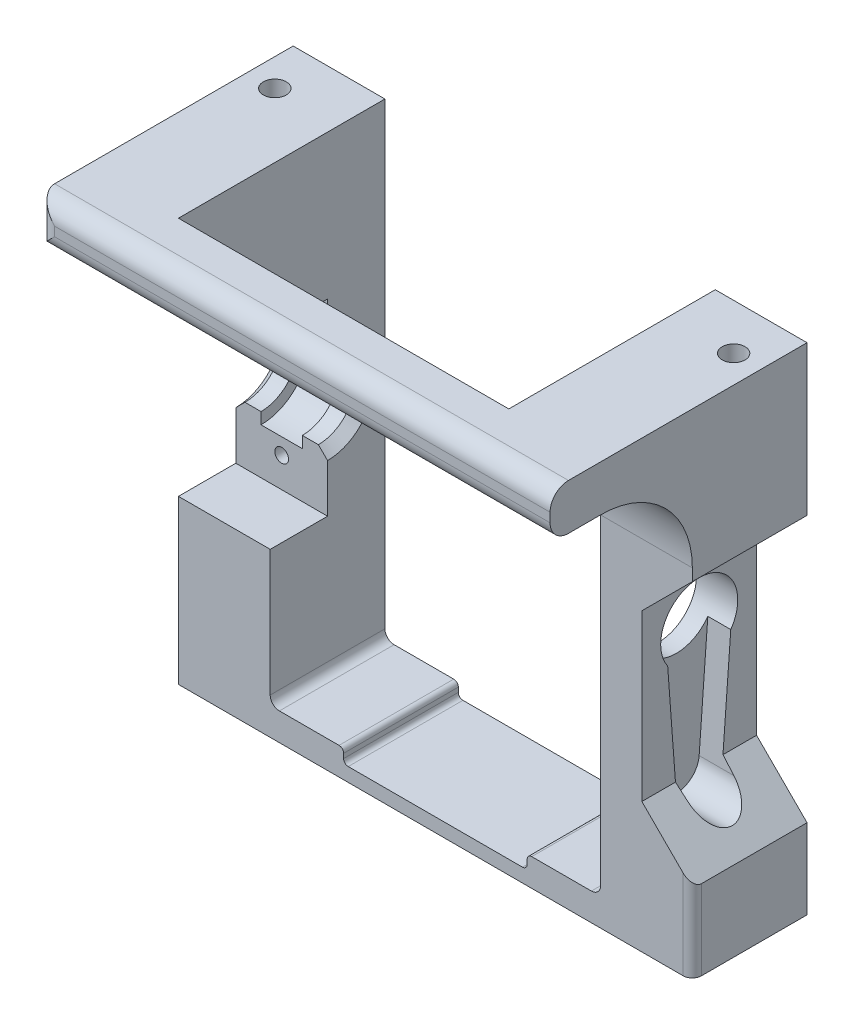
from build123d import *

# Parameters (mm, degrees)
SKETCH_1_W             = 56
SKETCH_1_H             = 54
EXTRUDE_492_DEPTH      = 12.5
SKETCH_3_W             = 36
SKETCH_3_H             = 46
CUT_EXTRUDE_735_DEPTH  = 41.856456038
SKETCH_11_R            = 1.25
CUT_EXTRUDE_988_DEPTH  = 10
CUT_EXTRUDE_1455_DEPTH = 8
CUT_EXTRUDE_1797_REACH = 65.413
SKETCH_4_R             = 4.2
SKETCH_6_R             = 4
CUT_EXTRUDE_1934_DEPTH = 10
SKETCH_7_W             = 6.25
SKETCH_7_H             = 20.5
CUT_EXTRUDE_2133_DEPTH = 10
SKETCH_8_R             = 5.25
CUT_EXTRUDE_2310_DEPTH = 2.25
SKETCH_9_R             = 0.75
CUT_EXTRUDE_2668_DEPTH = 4.75
CUT_EXTRUDE_3065_DEPTH = 41.856456038
CHAMFER_1_SIZE         = 1
FILLET_1_R             = 1
SKETCH_12_W            = 20
SKETCH_12_H            = 1.5
CUT_EXTRUDE_3477_DEPTH = 41.856456038
FILLET_2_R             = 0.5
CUT_EXTRUDE_4202_REACH = 42.856
SKETCH_13_W            = 36
SKETCH_13_H            = 5
EXTRUDE_4562_DEPTH     = 5
FILLET_3_R             = 10
FILLET_4_R             = 2
FILLET_6_R             = 1


with BuildPart() as part:
    # Эскиз1 → Extrude 492 (new body)
    with BuildSketch(Plane.XY):
        Rectangle(SKETCH_1_W, SKETCH_1_H)
    extrude(amount=EXTRUDE_492_DEPTH)

    # Эскиз3 → Cut-Extrude 735 (cut, through all)
    with BuildSketch(Plane.XY.offset(12.5)):
        with Locations((0, -1)):
            Rectangle(SKETCH_3_W, SKETCH_3_H)
    extrude(amount=-CUT_EXTRUDE_735_DEPTH, mode=Mode.SUBTRACT)

    # Эскиз11 → Cut-Extrude 988 (cut)
    with BuildSketch(Plane.XZ.offset(27)):
        with Locations(Location((-25, 5, 0), (0, 0, 270))):
            Circle(SKETCH_11_R)
        with Locations(Location((25, 5, 0), (0, 0, 270))):
            Circle(SKETCH_11_R)
    cut_extrude_988 = extrude(amount=-CUT_EXTRUDE_988_DEPTH, mode=Mode.SUBTRACT)

    # Mirror 1032: Cut-Extrude 988 across plane
    add(cut_extrude_988.mirror(Plane.ZX), mode=Mode.SUBTRACT)

    # Эскиз5 → Cut-Extrude 1455 (cut)
    with BuildSketch(Plane(origin=(28, 0, 0), x_dir=(0, 0, -1), z_dir=(1, 0, 0))):
        with BuildLine():
            Line((-9.688027281, -1.412461071), (-8.743079599, -14.085887362))
            ThreePointArc((-8.743079599, -14.085887362), (-6.25, -16.4), (-3.756920401, -14.085887362))
            Line((-3.756920401, -14.085887362), (-2.811972719, -1.412461071))
            ThreePointArc((-2.811972719, -1.412461071), (-6.25, 5.2), (-9.688027281, -1.412461071))
        make_face()
    extrude(amount=-CUT_EXTRUDE_1455_DEPTH, mode=Mode.SUBTRACT)

    # Эскиз4 → Cut-Extrude 1797 (cut, up to next)
    with BuildSketch(Plane(origin=(28, 0, 0), x_dir=(0, 0, -1), z_dir=(1, 0, 0)), mode=Mode.PRIVATE) as cut_extrude_1797_sk1:
        with Locations((-6.25, 1)):
            Circle(SKETCH_4_R)
    cut_extrude_1797_tool1 = extrude(cut_extrude_1797_sk1.sketch, amount=-CUT_EXTRUDE_1797_REACH, mode=Mode.PRIVATE) & part.part
    add(cut_extrude_1797_tool1.solids().sort_by_distance((28, 1, 6.25))[0], mode=Mode.SUBTRACT)

    # Эскиз6 → Cut-Extrude 1934 (cut)
    with BuildSketch(Plane.ZY.offset(28)):
        with Locations((6.25, 1)):
            Circle(SKETCH_6_R)
    extrude(amount=-CUT_EXTRUDE_1934_DEPTH, mode=Mode.SUBTRACT)

    # Эскиз7 → Cut-Extrude 2133 (cut)
    with BuildSketch(Plane.ZY.offset(28)):
        with Locations((9.375, 1)):
            Rectangle(SKETCH_7_W, SKETCH_7_H)
    extrude(amount=-CUT_EXTRUDE_2133_DEPTH, mode=Mode.SUBTRACT)

    # Эскиз8 → Cut-Extrude 2310 (cut, symmetric)
    with BuildSketch(Plane.ZY.offset(23)):
        with Locations((6.25, 1)):
            Circle(SKETCH_8_R)
    extrude(amount=CUT_EXTRUDE_2310_DEPTH, both=True, mode=Mode.SUBTRACT)

    # Эскиз9 → Cut-Extrude 2668 (cut)
    with BuildSketch(Plane.XY.offset(6.25)):
        with Locations((-23, 8)):
            Circle(SKETCH_9_R)
        with Locations((-23, -6)):
            Circle(SKETCH_9_R)
    extrude(amount=-CUT_EXTRUDE_2668_DEPTH, mode=Mode.SUBTRACT)

    # Эскиз10 → Cut-Extrude 3065 (cut, through all)
    with BuildSketch(Plane.XY.offset(12.5)):
        Polygon((28, -18.3), (28, 10.7), (22.5, 5.2), (22.5, -12.8), align=None)
    extrude(amount=-CUT_EXTRUDE_3065_DEPTH, mode=Mode.SUBTRACT)

    # Фаска1
    chamfer_1_edges = [part.edges().sort_by_distance(p)[0] for p in [
        (-28, 1, 2.25),
        (-18, 1, 2.25),
    ]]
    chamfer(chamfer_1_edges, length=CHAMFER_1_SIZE)

    # Скругление1
    fillet_1_edges = [part.edges().sort_by_distance(p)[0] for p in [
        (18, -24, 6.25),
        (-18, -24, 6.25),
    ]]
    fillet(fillet_1_edges, radius=FILLET_1_R)

    # Эскиз12 → Cut-Extrude 3477 (cut, through all)
    with BuildSketch(Plane.XY):
        with Locations((0, -24.75)):
            Rectangle(SKETCH_12_W, SKETCH_12_H)
    extrude(amount=CUT_EXTRUDE_3477_DEPTH, mode=Mode.SUBTRACT)

    # Скругление2
    fillet_2_edges = [part.edges().sort_by_distance(p)[0] for p in [
        (-10, -24, 6.25),
        (-10, -25.5, 6.25),
        (10, -25.5, 6.25),
        (10, -24, 6.25),
    ]]
    fillet(fillet_2_edges, radius=FILLET_2_R)

    # Эскиз13 → Cut-Extrude 4202 (cut, up to next)
    with BuildSketch(Plane.XY.offset(12.5), mode=Mode.PRIVATE) as cut_extrude_4202_sk1:
        with Locations((0, 24.5)):
            Rectangle(SKETCH_13_W, SKETCH_13_H)
    cut_extrude_4202_tool1 = extrude(cut_extrude_4202_sk1.sketch, amount=-CUT_EXTRUDE_4202_REACH, mode=Mode.PRIVATE) & part.part
    add(cut_extrude_4202_tool1.solids().sort_by_distance((0, 24.5, 12.5))[0], mode=Mode.SUBTRACT)

    # Эскиз14 → Extrude 4562 (add)
    with BuildSketch(Plane(origin=(0, 27, 0), x_dir=(1, 0, 0), z_dir=(0, 1, 0))):
        Polygon((-28, -12.5), (-28, -28), (28, -28), (28, -12.5), (18, -12.5), (18, -22.5), (-18, -22.5), (-18, -12.5), align=None)
    extrude(amount=-EXTRUDE_4562_DEPTH)

    # Скругление3
    fillet_3_edges = [part.edges().sort_by_distance(p)[0] for p in [
        (23, 22, 12.5),
        (-23, 22, 12.5),
    ]]
    fillet(fillet_3_edges, radius=FILLET_3_R)

    # Скругление4
    fillet_4_edges = [part.edges().sort_by_distance(p)[0] for p in [
        (0, 22, 22.5),
        (0, 22, 28),
        (-28, 24.5, 28),
        (0, 27, 28),
    ]]
    fillet(fillet_4_edges, radius=FILLET_4_R)

    # Скругление6
    fillet_6_edges = [part.edges().sort_by_distance(p)[0] for p in [
        (28, -22.65, 12.5),
    ]]
    fillet(fillet_6_edges, radius=FILLET_6_R)


solid = part.part
